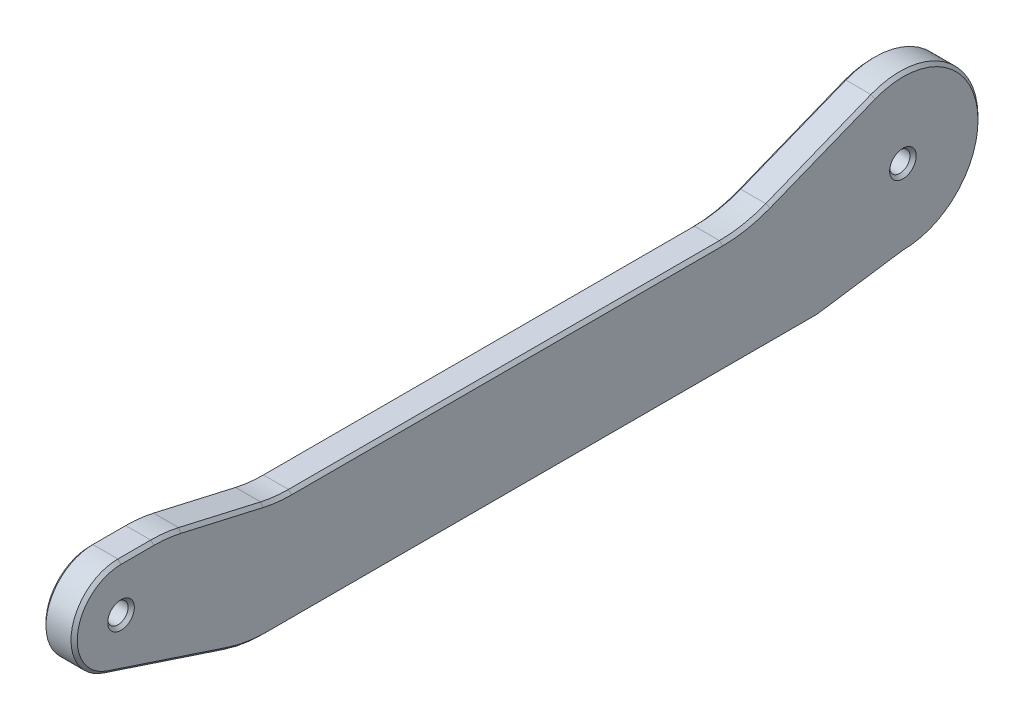
from build123d import *

# Parameters (mm, degrees)
SKETCH_1_R      = 1.625
SKETCH_1_R_2    = 1.5
EXTRUDE_1_DEPTH = 5
CHAMFER_1_SIZE  = 0.5
EXTRUDE_2_DEPTH = 5


with BuildPart() as part:
    # 草图1 → 凸台-拉伸1 (new body)
    with BuildSketch(Plane(origin=(2.5, 0, 0), x_dir=(0, 0, -1), z_dir=(1, 0, 0))):
        with BuildLine():
            Line((-28.835359751, 3.5), (-97.743384645, 3.5))
            ThreePointArc((-97.743384645, 3.5), (-99.985771473, 3.626105029), (-102.199880675, 4.002829869))
            Line((-102.199880675, 4.002829869), (-115.300119325, 6.997170131))
            ThreePointArc((-115.300119325, 6.997170131), (-117.514228527, 7.373894971), (-119.756615355, 7.5))
            Line((-119.756615355, 7.5), (-125, 7.5))
            ThreePointArc((-125, 7.5), (-132.404899181, 1.190574699), (-127.350956164, -7.122008503))
            Line((-127.350956164, -7.122008503), (-108.053575901, -13.492022674))
            ThreePointArc((-108.053575901, -13.492022674), (-104.959225327, -14.246397817), (-101.784359462, -14.5))
            Line((-101.784359462, -14.5), (-13.675, -14.5))
            Line((-13.675, -14.5), (0, -12.5))
            ThreePointArc((0, -12.5), (12.276307634, 2.354202809), (-4.624146867, 11.613236661))
            Line((-4.624146867, 11.613236661), (-21.436724763, 4.918821342))
            ThreePointArc((-21.436724763, 4.918821342), (-25.068635256, 3.857907785), (-28.835359751, 3.5))
        make_face()
        with Locations(Location((-125, 0, 0), (0, 0, 180))):
            Circle(SKETCH_1_R, mode=Mode.SUBTRACT)
        with Locations(Location((-97.5, -5.5, 0), (0, 0, 180))):
            Circle(SKETCH_1_R_2, mode=Mode.SUBTRACT)
        with Locations(Location((-20, -5.5, 0), (0, 0, 180))):
            Circle(SKETCH_1_R_2, mode=Mode.SUBTRACT)
        with Locations(Location((0, 0, 0), (0, 0, 180))):
            Circle(SKETCH_1_R, mode=Mode.SUBTRACT)
        with BuildLine():
            Line((-87.5, -4), (-32.5, -4))
            ThreePointArc((-32.5, -4), (-31, -5.5), (-32.5, -7))
            Line((-32.5, -7), (-87.5, -7))
            ThreePointArc((-87.5, -7), (-89, -5.5), (-87.5, -4))
        make_face(mode=Mode.SUBTRACT)
    extrude(amount=-EXTRUDE_1_DEPTH)

    # 倒角1
    chamfer_1_edges = [part.edges().sort_by_distance(p)[0] for p in [
        (-2.5, 3.626105029, 99.985771473),
        (2.5, 8.266029002, 13.030435815),
        (2.5, 2.354202809, -12.276307634),
        (2.5, -13.5, 6.8375),
        (2.5, -14.5, 57.729679731),
        (2.5, -14.246397817, 104.959225327),
        (2.5, -10.307015588, 117.702266032),
        (2.5, 1.190574699, 132.404899181),
        (2.5, 7.5, 122.378307678),
        (2.5, 7.373894971, 117.514228527),
        (2.5, 5.5, 108.75),
        (-2.5, 5.5, 108.75),
        (2.5, 3.626105029, 99.985771473),
        (2.5, 3.5, 63.289372198),
        (2.5, 3.857907785, 25.068635256),
        (-2.5, 7.373894971, 117.514228527),
        (-2.5, 7.5, 122.378307678),
        (-2.5, 1.190574699, 132.404899181),
        (-2.5, -10.307015588, 117.702266032),
        (-2.5, 0, 123.375),
        (2.5, 0, 123.375),
        (-2.5, -14.246397817, 104.959225327),
        (-2.5, -5.5, 96),
        (2.5, -5.5, 96),
        (-2.5, -5.5, 18.5),
        (-2.5, -14.5, 57.729679731),
        (2.5, -5.5, 18.5),
        (-2.5, -13.5, 6.8375),
        (-2.5, -5.5, 89),
        (-2.5, -4, 60),
        (-2.5, -5.5, 31),
        (-2.5, -7, 60),
        (-2.5, 2.354202809, -12.276307634),
        (2.5, -5.5, 89),
        (2.5, -7, 60),
        (2.5, -5.5, 31),
        (2.5, -4, 60),
        (-2.5, 3.857907785, 25.068635256),
        (-2.5, 8.266029002, 13.030435815),
        (-2.5, 0, -1.625),
        (2.5, 0, -1.625),
        (-2.5, 3.5, 63.289372198),
    ]]
    chamfer(chamfer_1_edges, length=CHAMFER_1_SIZE)

    # Sketch 3D_1 → 凸台-拉伸2 (add)
    with BuildSketch(Plane(origin=(2.5, 0.724565904, 106.04601189), x_dir=(0, -0.10344866174004491, -0.9946347944769446), z_dir=(-1, 0, 0))):
        Polygon((0, 0), (92.493650367, -9.619957398), (96.694027737, 0), (73.434795042, 4.428728496), (1.034783284, 9.949200326), align=None)
    extrude(amount=EXTRUDE_2_DEPTH)


solid = part.part
